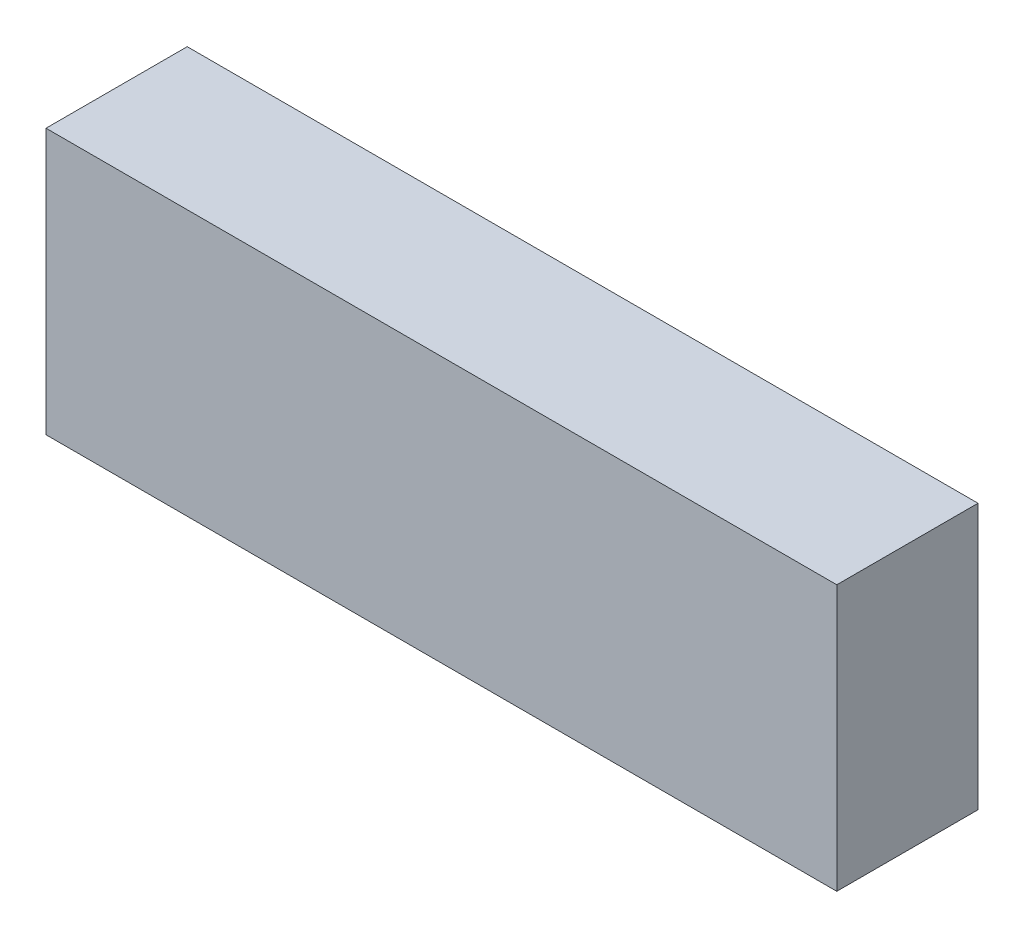
from build123d import *

# Parameters (mm, degrees)
CROQUIS1_W              = 140
CROQUIS1_H              = 47
SALIENTE_EXTRUIR1_DEPTH = 25


with BuildPart() as part:
    # Croquis1 → Saliente-Extruir1 (new body)
    with BuildSketch(Plane.XY):
        Rectangle(CROQUIS1_W, CROQUIS1_H)
    extrude(amount=SALIENTE_EXTRUIR1_DEPTH)


solid = part.part
